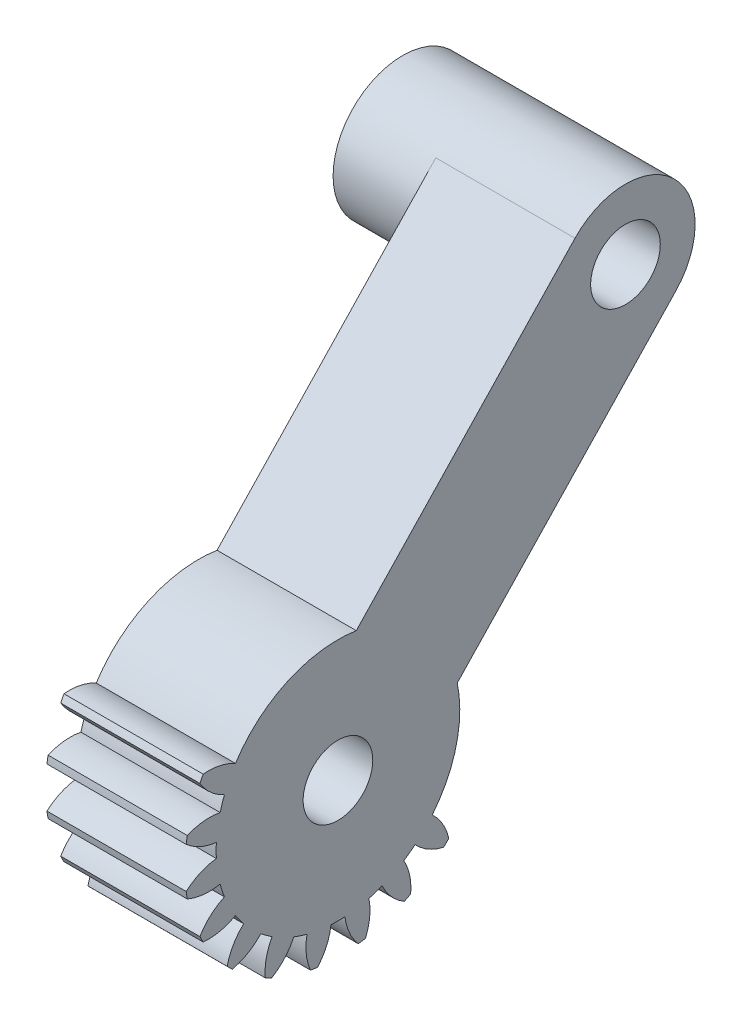
from build123d import *

# Parameters (mm, degrees)
SKETCH1_R           = 2.5
BOSS_EXTRUDE1_DEPTH = 10
SKETCH2_R           = 2.5
BOSS_EXTRUDE2_DEPTH = 10
SKETCH3_R           = 5
SKETCH3_R_2         = 2.5
BOSS_EXTRUDE3_DEPTH = 6
SKETCH4_R           = 2.5
CUT_EXTRUDE1_DEPTH  = 6
CUT_EXTRUDE2_DEPTH  = 41.209967862


with BuildPart() as part:
    # Sketch1 → Boss-Extrude1 (new body)
    with BuildSketch(Plane(origin=(4.043870029, 0, 0), x_dir=(0, 0, -1), z_dir=(1, 0, 0))):
        with BuildLine():
            ThreePointArc((-10.029541992, 0.342879069), (-9.019080639, -0.304016541), (-7.862233613, -0.622153359))
            ThreePointArc((-7.862233613, -0.622153359), (-7.876528296, -1.122077366), (-7.862233613, -1.622001374))
            ThreePointArc((-7.862233613, -1.622001374), (-9.019080639, -1.940138191), (-10.029541992, -2.587033801))
            ThreePointArc((-10.029541992, -2.587033801), (-9.992100042, -2.842856482), (-9.948655897, -3.097728508))
            ThreePointArc((-9.948655897, -3.097728508), (-8.787748306, -3.400713063), (-7.58921172, -3.345793765))
            ThreePointArc((-7.58921172, -3.345793765), (-7.448321757, -3.82566705), (-7.280241692, -4.296705735))
            ThreePointArc((-7.280241692, -4.296705735), (-8.282158911, -4.956757219), (-9.043263028, -5.884241235))
            ThreePointArc((-9.043263028, -5.884241235), (-8.928600062, -6.115972863), (-8.808522437, -6.344945585))
            ThreePointArc((-8.808522437, -6.344945585), (-7.610806331, -6.274360846), (-6.487901298, -5.851761317))
            ThreePointArc((-6.487901298, -5.851761317), (-6.20561798, -6.264610538), (-5.90020538, -6.660655353))
            ThreePointArc((-5.90020538, -6.660655353), (-6.649118154, -7.598011066), (-7.086362862, -8.715294889))
            ThreePointArc((-7.086362862, -8.715294889), (-6.905702889, -8.900251959), (-6.720745819, -9.080911932))
            ThreePointArc((-6.720745819, -9.080911932), (-5.603461996, -8.643667224), (-4.666106283, -7.89475445))
            ThreePointArc((-4.666106283, -7.89475445), (-4.270061468, -8.20016705), (-3.857212247, -8.482450368))
            ThreePointArc((-3.857212247, -8.482450368), (-4.279811776, -9.605355401), (-4.350396515, -10.803071507))
            ThreePointArc((-4.350396515, -10.803071507), (-4.121423793, -10.923149132), (-3.889692165, -11.037812099))
            ThreePointArc((-3.889692165, -11.037812099), (-2.962208149, -10.276707981), (-2.302156665, -9.274790762))
            ThreePointArc((-2.302156665, -9.274790762), (-1.83111798, -9.442870827), (-1.351244695, -9.583760791))
            ThreePointArc((-1.351244695, -9.583760791), (-1.406163992, -10.782297376), (-1.103179437, -11.943204968))
            ThreePointArc((-1.103179437, -11.943204968), (-0.848307411, -11.986649113), (-0.592484731, -12.024091063))
            ThreePointArc((-0.592484731, -12.024091063), (0.054410879, -11.01362971), (0.372547697, -9.856782684))
            ThreePointArc((0.372547697, -9.856782684), (0.872471704, -9.871077366), (1.372395712, -9.856782684))
            ThreePointArc((1.372395712, -9.856782684), (1.690532529, -11.01362971), (2.337428139, -12.024091063))
            ThreePointArc((2.337428139, -12.024091063), (2.59325082, -11.986649113), (2.848122846, -11.943204968))
            ThreePointArc((2.848122846, -11.943204968), (3.151107401, -10.782297376), (3.096188103, -9.583760791))
            ThreePointArc((3.096188103, -9.583760791), (3.576061388, -9.442870827), (4.047100073, -9.274790762))
            ThreePointArc((4.047100073, -9.274790762), (4.707151558, -10.276707981), (5.634635573, -11.037812099))
            ThreePointArc((5.634635573, -11.037812099), (5.866367201, -10.923149132), (6.095339923, -10.803071507))
            ThreePointArc((6.095339923, -10.803071507), (6.024755184, -9.605355401), (5.602155655, -8.482450368))
            ThreePointArc((5.602155655, -8.482450368), (6.015004877, -8.20016705), (6.411049691, -7.89475445))
            ThreePointArc((6.411049691, -7.89475445), (7.348405404, -8.643667224), (8.465689227, -9.080911932))
            ThreePointArc((8.465689227, -9.080911932), (8.650646297, -8.900251959), (8.83130627, -8.715294889))
            ThreePointArc((8.83130627, -8.715294889), (8.394061563, -7.598011066), (7.645148788, -6.660655353))
            ThreePointArc((7.645148788, -6.660655353), (7.950561388, -6.264610538), (8.232844706, -5.851761317))
            ThreePointArc((8.232844706, -5.851761317), (9.355749739, -6.274360846), (10.553465846, -6.344945585))
            ThreePointArc((10.553465846, -6.344945585), (10.67354347, -6.115972863), (10.788206437, -5.884241235))
            ThreePointArc((10.788206437, -5.884241235), (10.02710232, -4.956757219), (9.0251851, -4.296705735))
            ThreePointArc((9.0251851, -4.296705735), (9.193265165, -3.82566705), (9.334155129, -3.345793765))
            ThreePointArc((9.334155129, -3.345793765), (10.532691714, -3.400713063), (11.693599306, -3.097728508))
            ThreePointArc((11.693599306, -3.097728508), (11.737043451, -2.842856482), (11.774485401, -2.587033801))
            ThreePointArc((11.774485401, -2.587033801), (10.764024048, -1.940138191), (9.607177022, -1.622001374))
            ThreePointArc((9.607177022, -1.622001374), (9.621471704, -1.122077366), (9.607177022, -0.622153359))
            ThreePointArc((9.607177022, -0.622153359), (10.764024048, -0.304016541), (11.774485401, 0.342879069))
            ThreePointArc((11.774485401, 0.342879069), (11.737043451, 0.598701749), (11.693599306, 0.853573775))
            ThreePointArc((11.693599306, 0.853573775), (10.532691714, 1.156558331), (9.334155129, 1.101639033))
            ThreePointArc((9.334155129, 1.101639033), (9.193265165, 1.581512318), (9.0251851, 2.052551003))
            ThreePointArc((9.0251851, 2.052551003), (10.02710232, 2.712602487), (10.788206437, 3.640086503))
            ThreePointArc((10.788206437, 3.640086503), (10.67354347, 3.871818131), (10.553465846, 4.100790853))
            ThreePointArc((10.553465846, 4.100790853), (9.355749739, 4.030206114), (8.232844706, 3.607606585))
            ThreePointArc((8.232844706, 3.607606585), (7.950561388, 4.020455806), (7.645148788, 4.416500621))
            ThreePointArc((7.645148788, 4.416500621), (8.394061563, 5.353856334), (8.83130627, 6.471140157))
            ThreePointArc((8.83130627, 6.471140157), (8.650646297, 6.656097227), (8.465689227, 6.8367572))
            ThreePointArc((8.465689227, 6.8367572), (7.348405404, 6.399512492), (6.411049691, 5.650599718))
            ThreePointArc((6.411049691, 5.650599718), (6.015004877, 5.956012318), (5.602155655, 6.238295636))
            ThreePointArc((5.602155655, 6.238295636), (6.024755184, 7.361200669), (6.095339923, 8.558916775))
            ThreePointArc((6.095339923, 8.558916775), (5.866367201, 8.6789944), (5.634635573, 8.793657366))
            ThreePointArc((5.634635573, 8.793657366), (4.707151558, 8.032553249), (4.047100073, 7.03063603))
            ThreePointArc((4.047100073, 7.03063603), (3.576061388, 7.198716095), (3.096188103, 7.339606058))
            ThreePointArc((3.096188103, 7.339606058), (3.151107401, 8.538142644), (2.848122846, 9.699050235))
            ThreePointArc((2.848122846, 9.699050235), (2.59325082, 9.74249438), (2.337428139, 9.779936331))
            ThreePointArc((2.337428139, 9.779936331), (1.690532529, 8.769474978), (1.372395712, 7.612627952))
            ThreePointArc((1.372395712, 7.612627952), (0.872471704, 7.626922634), (0.372547697, 7.612627952))
            ThreePointArc((0.372547697, 7.612627952), (0.054410879, 8.769474978), (-0.592484731, 9.779936331))
            ThreePointArc((-0.592484731, 9.779936331), (-0.848307411, 9.74249438), (-1.103179437, 9.699050235))
            ThreePointArc((-1.103179437, 9.699050235), (-1.406163992, 8.538142644), (-1.351244695, 7.339606058))
            ThreePointArc((-1.351244695, 7.339606058), (-1.83111798, 7.198716095), (-2.302156665, 7.03063603))
            ThreePointArc((-2.302156665, 7.03063603), (-2.962208149, 8.032553249), (-3.889692165, 8.793657366))
            ThreePointArc((-3.889692165, 8.793657366), (-4.121423793, 8.6789944), (-4.350396515, 8.558916775))
            ThreePointArc((-4.350396515, 8.558916775), (-4.279811776, 7.361200669), (-3.857212247, 6.238295636))
            ThreePointArc((-3.857212247, 6.238295636), (-4.270061468, 5.956012318), (-4.666106283, 5.650599718))
            ThreePointArc((-4.666106283, 5.650599718), (-5.603461996, 6.399512492), (-6.720745819, 6.8367572))
            ThreePointArc((-6.720745819, 6.8367572), (-6.905702889, 6.656097227), (-7.086362862, 6.471140157))
            ThreePointArc((-7.086362862, 6.471140157), (-6.649118154, 5.353856334), (-5.90020538, 4.416500621))
            ThreePointArc((-5.90020538, 4.416500621), (-6.20561798, 4.020455806), (-6.487901298, 3.607606585))
            ThreePointArc((-6.487901298, 3.607606585), (-7.610806331, 4.030206114), (-8.808522437, 4.100790853))
            ThreePointArc((-8.808522437, 4.100790853), (-8.928600062, 3.871818131), (-9.043263028, 3.640086503))
            ThreePointArc((-9.043263028, 3.640086503), (-8.282158911, 2.712602487), (-7.280241692, 2.052551003))
            ThreePointArc((-7.280241692, 2.052551003), (-7.448321757, 1.581512318), (-7.58921172, 1.101639033))
            ThreePointArc((-7.58921172, 1.101639033), (-8.787748306, 1.156558331), (-9.948655897, 0.853573775))
            ThreePointArc((-9.948655897, 0.853573775), (-9.992100042, 0.598701749), (-10.029541992, 0.342879069))
        make_face()
        with Locations(Location((0.872471704, -1.122077366, 0), (0, 0, 180))):
            Circle(SKETCH1_R, mode=Mode.SUBTRACT)
    extrude(amount=-BOSS_EXTRUDE1_DEPTH)

    # Sketch2 → Boss-Extrude2 (add)
    with BuildSketch(Plane(origin=(4.043870029, 0, 0), x_dir=(0, 0, -1), z_dir=(1, 0, 0))):
        with BuildLine():
            Line((-2.754400151, 2.319695512), (17.89623712, 24.080926643))
            ThreePointArc((17.89623712, 24.080926643), (24.964881853, 24.266025619), (25.14998083, 17.197380886))
            Line((25.14998083, 17.197380886), (4.499343559, -4.563850245))
            ThreePointArc((4.499343559, -4.563850245), (-2.569301174, -4.748949221), (-2.754400151, 2.319695512))
        make_face()
        with Locations((21.523108975, 20.639153764)):
            Circle(SKETCH2_R, mode=Mode.SUBTRACT)
    extrude(amount=-BOSS_EXTRUDE2_DEPTH)

    # Sketch3 → Boss-Extrude3 (add)
    with BuildSketch(Plane.ZY.offset(5.956129971)):
        with Locations(Location((-21.523108975, 20.639153764, 0), (0, 0, 223.5))):
            Circle(SKETCH3_R)
        with Locations(Location((-21.523108975, 20.639153764, 0), (0, 0, 180))):
            Circle(SKETCH3_R_2, mode=Mode.SUBTRACT)
    extrude(amount=BOSS_EXTRUDE3_DEPTH)

    # Sketch4 → Cut-Extrude1 (cut)
    with BuildSketch(Plane(origin=(4.043870029, 0, 0), x_dir=(0, 0, -1), z_dir=(1, 0, 0))):
        with Locations((0.872471704, -1.122077366)):
            Circle(SKETCH4_R)
    extrude(amount=-CUT_EXTRUDE1_DEPTH, mode=Mode.SUBTRACT)

    # Sketch6 → Cut-Extrude2 (cut, through all)
    with BuildSketch(Plane(origin=(4.043870029, 0, 0), x_dir=(0, 0, -1), z_dir=(1, 0, 0))):
        with BuildLine():
            Line((4.579688985, 10.048212881), (2.187631015, 7.527509733))
            ThreePointArc((2.187631015, 7.527509733), (-2.46576826, 6.965020688), (-6.16100093, 4.08131227))
            Line((-6.16100093, 4.08131227), (-8.58915512, 5.877669916))
            ThreePointArc((-8.58915512, 5.877669916), (-2.68093011, 10.098091069), (4.579688985, 10.048212881))
        make_face()
        with BuildLine():
            Line((11.833432695, 3.164667124), (9.441374725, 0.643963976))
            ThreePointArc((9.441374725, 0.643963976), (9.424184018, -2.969566881), (7.948146758, -6.267932352))
            Line((7.948146758, -6.267932352), (10.39087042, -8.044427405))
            ThreePointArc((10.39087042, -8.044427405), (12.54560297, -2.624359175), (11.833432695, 3.164667124))
        make_face()
    extrude(amount=-CUT_EXTRUDE2_DEPTH, mode=Mode.SUBTRACT)


solid = part.part
